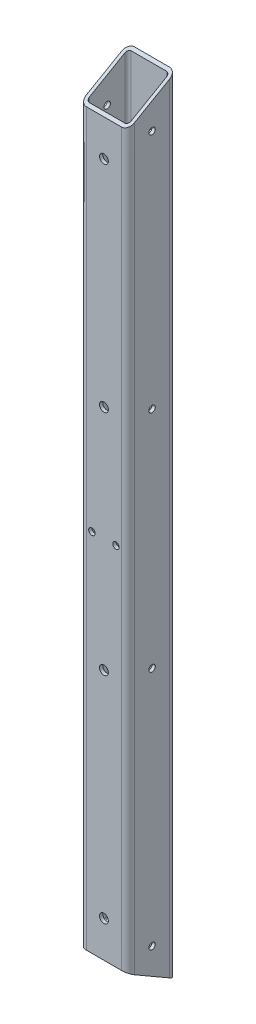
from build123d import *

# Parameters (mm, degrees)
EXTRUDE_1_DEPTH          = 245
SKETCH_2_R               = 2
SKETCH_2_R_2             = 2.75
CUT_EXTRUDE_1_DEPTH      = 249.646335183
CUT_EXTRUDE_3_DEPTH      = 249.646335183
CUT_EXTRUDE_3_DEPTH_BACK = 249.646335183
SKETCH_4_R               = 2
CUT_EXTRUDE_4_DEPTH      = 249.646335183


with BuildPart() as part:
    # 草图1 → 凸台-拉伸1 (new, symmetric)
    with BuildSketch(Plane(origin=(0, 0, 0), x_dir=(1, 0, 0), z_dir=(0, 1, 0))):
        with BuildLine():
            Line((4, 0), (26, 0))
            ThreePointArc((26, 0), (28.828427125, 1.171572875), (30, 4))
            Line((30, 4), (30, 26))
            ThreePointArc((30, 26), (28.828427125, 28.828427125), (26, 30))
            Line((26, 30), (4, 30))
            ThreePointArc((4, 30), (1.171572875, 28.828427125), (0, 26))
            Line((0, 26), (0, 4))
            ThreePointArc((0, 4), (1.171572875, 1.171572875), (4, 0))
        make_face()
        with BuildLine():
            Line((4, 2), (26, 2))
            ThreePointArc((26, 2), (27.414213562, 2.585786438), (28, 4))
            Line((28, 4), (28, 26))
            ThreePointArc((28, 26), (27.414213562, 27.414213562), (26, 28))
            Line((26, 28), (4, 28))
            ThreePointArc((4, 28), (2.585786438, 27.414213562), (2, 26))
            Line((2, 26), (2, 4))
            ThreePointArc((2, 4), (2.585786438, 2.585786438), (4, 2))
        make_face(mode=Mode.SUBTRACT)
    extrude(amount=EXTRUDE_1_DEPTH, both=True)

    # 草图2 → 切除-拉伸1 (cut, through all)
    with BuildSketch(Plane(origin=(0, 0, 0), x_dir=(-1, 0, 0), z_dir=(0, 0, -1))):
        with Locations(Location((-22.5, 0, 0), (0, 0, 180))):
            Circle(SKETCH_2_R)
        with Locations(Location((-7.5, 0, 0), (0, 0, 180))):
            Circle(SKETCH_2_R)
        with Locations(Location((-15, 205, 0), (0, 0, 180))):
            Circle(SKETCH_2_R_2)
        with Locations(Location((-15, 71, 0), (0, 0, 180))):
            Circle(SKETCH_2_R_2)
        with Locations(Location((-15, -71, 0), (0, 0, 180))):
            Circle(SKETCH_2_R_2)
        with Locations(Location((-15, -205, 0), (0, 0, 180))):
            Circle(SKETCH_2_R_2)
    extrude(amount=CUT_EXTRUDE_1_DEPTH, mode=Mode.SUBTRACT)

    # 草图3 → 切除-拉伸3 (cut, two sides: drawn at the far end of the back side and taken through both)
    with BuildSketch(Plane(origin=(0, 0, 0), x_dir=(0, 0, -1), z_dir=(1, 0, 0)).offset(-CUT_EXTRUDE_3_DEPTH_BACK)):
        Polygon((30, 245), (0, 227.679491924), (0, 245), align=None)
        Polygon((0, -245), (30, -245), (0, -227.679491924), align=None)
    extrude(amount=CUT_EXTRUDE_3_DEPTH + CUT_EXTRUDE_3_DEPTH_BACK, mode=Mode.SUBTRACT)

    # 草图4 → 切除-拉伸4 (cut, through all)
    with BuildSketch(Plane(origin=(0, 0, 0), x_dir=(0, 0, -1), z_dir=(1, 0, 0))):
        with Locations(Location((15, 220, 0), (0, 0, 180))):
            Circle(SKETCH_4_R)
        with Locations(Location((15, 70, 0), (0, 0, 180))):
            Circle(SKETCH_4_R)
        with Locations(Location((15, -70, 0), (0, 0, 180))):
            Circle(SKETCH_4_R)
        with Locations(Location((15, -220, 0), (0, 0, 180))):
            Circle(SKETCH_4_R)
    extrude(amount=CUT_EXTRUDE_4_DEPTH, mode=Mode.SUBTRACT)


solid = part.part
